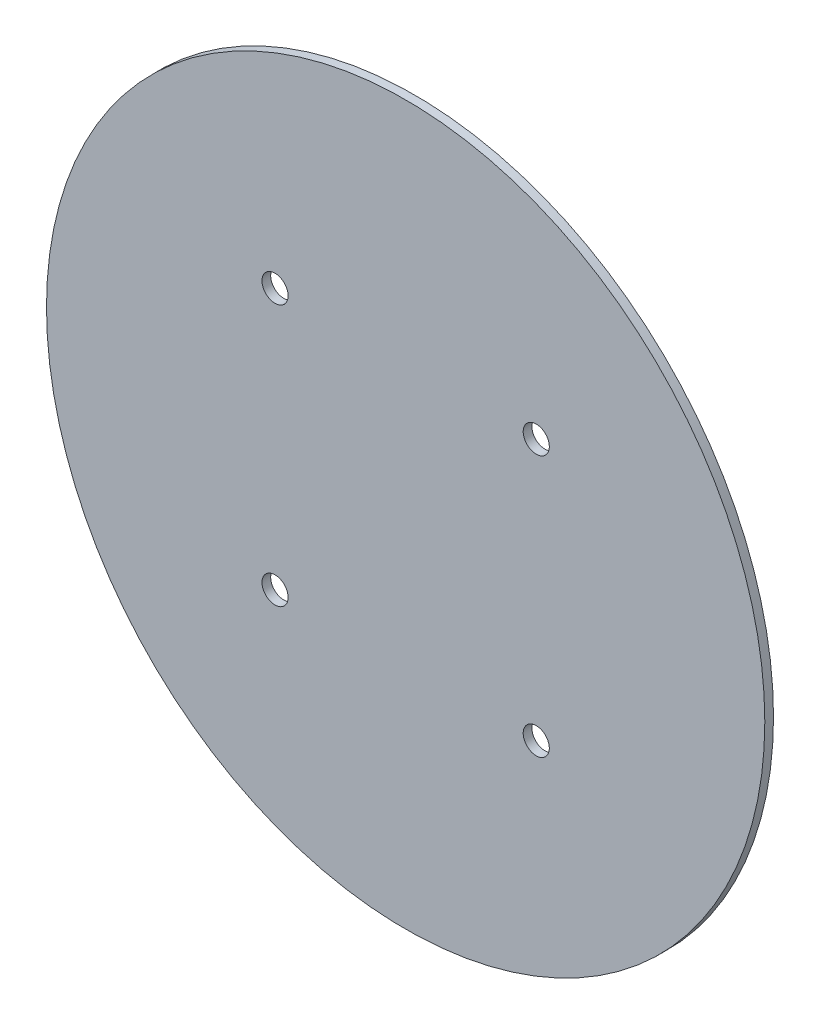
from build123d import *

# Parameters (mm, degrees)
SKETCH_1_R          = 82.5
EXTRUDE_1_DEPTH     = 2
SKETCH_2_R          = 3
CUT_EXTRUDE_1_DEPTH = 117.689759619


with BuildPart() as part:
    # 草图1 → 凸台-拉伸1 (new body)
    with BuildSketch(Plane.XY):
        Circle(SKETCH_1_R)
    extrude(amount=EXTRUDE_1_DEPTH)

    # 草图2 → 切除-拉伸1 (cut, through all)
    with BuildSketch(Plane.XY.offset(2)):
        with Locations((30, 30)):
            Circle(SKETCH_2_R)
        with Locations((-30, 30)):
            Circle(SKETCH_2_R)
        with Locations((-30, -30)):
            Circle(SKETCH_2_R)
        with Locations((30, -30)):
            Circle(SKETCH_2_R)
    extrude(amount=-CUT_EXTRUDE_1_DEPTH, mode=Mode.SUBTRACT)


solid = part.part
